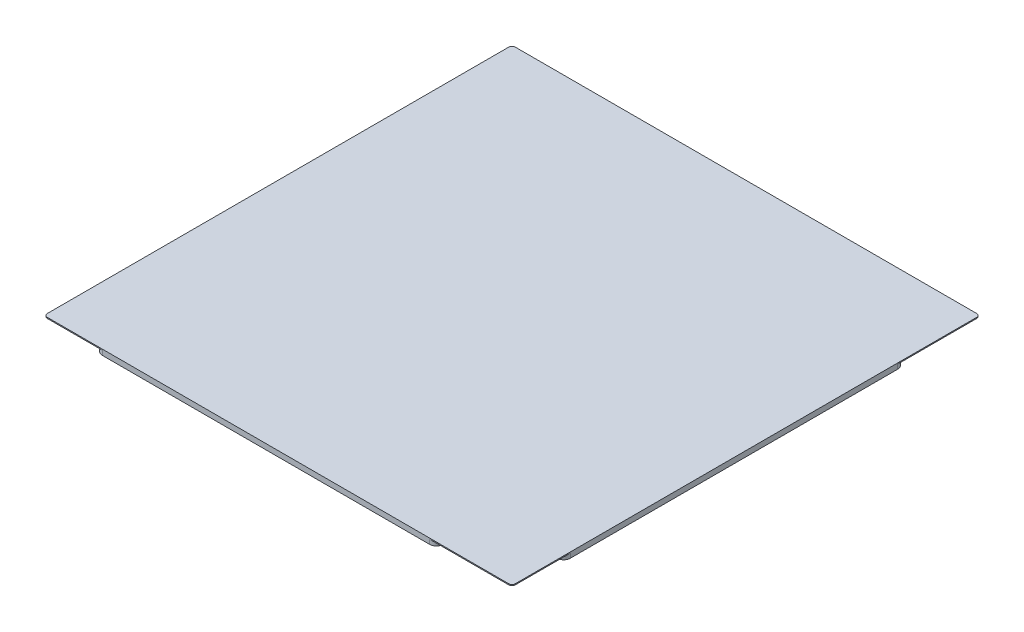
from build123d import *

# Parameters (mm, degrees)
SKETCH1_W           = 136.7
SKETCH1_H           = 136.7
BOSS_EXTRUDE1_DEPTH = 0.15
SKETCH2_W           = 13.5
SKETCH2_H           = 99.566666666
SKETCH2_W_2         = 99.566666666
SKETCH2_H_2         = 13.5
BOSS_EXTRUDE2_DEPTH = 1.3
FILLET1_R           = 2
FILLET2_R           = 1


with BuildPart() as part:
    # Sketch1 → Boss-Extrude1 (new, symmetric)
    with BuildSketch(Plane(origin=(0, 0, 0), x_dir=(1, 0, 0), z_dir=(0, 1, 0))):
        Rectangle(SKETCH1_W, SKETCH1_H)
    extrude(amount=BOSS_EXTRUDE1_DEPTH, both=True)

    # Sketch2 → Boss-Extrude2 (add)
    with BuildSketch(Plane.XZ.offset(0.15)):
        with Locations((-61.6, -3.5)):
            Rectangle(SKETCH2_W, SKETCH2_H)
        with Locations((3.5, -61.6)):
            Rectangle(SKETCH2_W_2, SKETCH2_H_2)
        with Locations((-3.5, 61.6)):
            Rectangle(SKETCH2_W_2, SKETCH2_H_2)
        with Locations((61.6, 3.5)):
            Rectangle(SKETCH2_W, SKETCH2_H)
    extrude(amount=BOSS_EXTRUDE2_DEPTH)

    # Fillet1
    fillet1_edges = [part.edges().sort_by_distance(p)[0] for p in [
        (53.283333333, -0.8, -68.35),
        (53.283333333, -0.8, -54.85),
        (-46.283333333, -0.8, -54.85),
        (-46.283333333, -0.8, -68.35),
        (-54.85, -0.8, -53.283333333),
        (-54.85, -0.8, 46.283333333),
        (-68.35, -0.8, 46.283333333),
        (-68.35, -0.8, -53.283333333),
        (-53.283333333, -0.8, 54.85),
        (46.283333333, -0.8, 54.85),
        (46.283333333, -0.8, 68.35),
        (-53.283333333, -0.8, 68.35),
        (54.85, -0.8, 53.283333333),
        (54.85, -0.8, -46.283333333),
        (68.35, -0.8, -46.283333333),
        (68.35, -0.8, 53.283333333),
    ]]
    fillet(fillet1_edges, radius=FILLET1_R)

    # Fillet2
    fillet2_edges = [part.edges().sort_by_distance(p)[0] for p in [
        (68.35, 0, 68.35),
        (-68.35, 0, 68.35),
        (-68.35, 0, -68.35),
        (68.35, 0, -68.35),
    ]]
    fillet(fillet2_edges, radius=FILLET2_R)


solid = part.part
